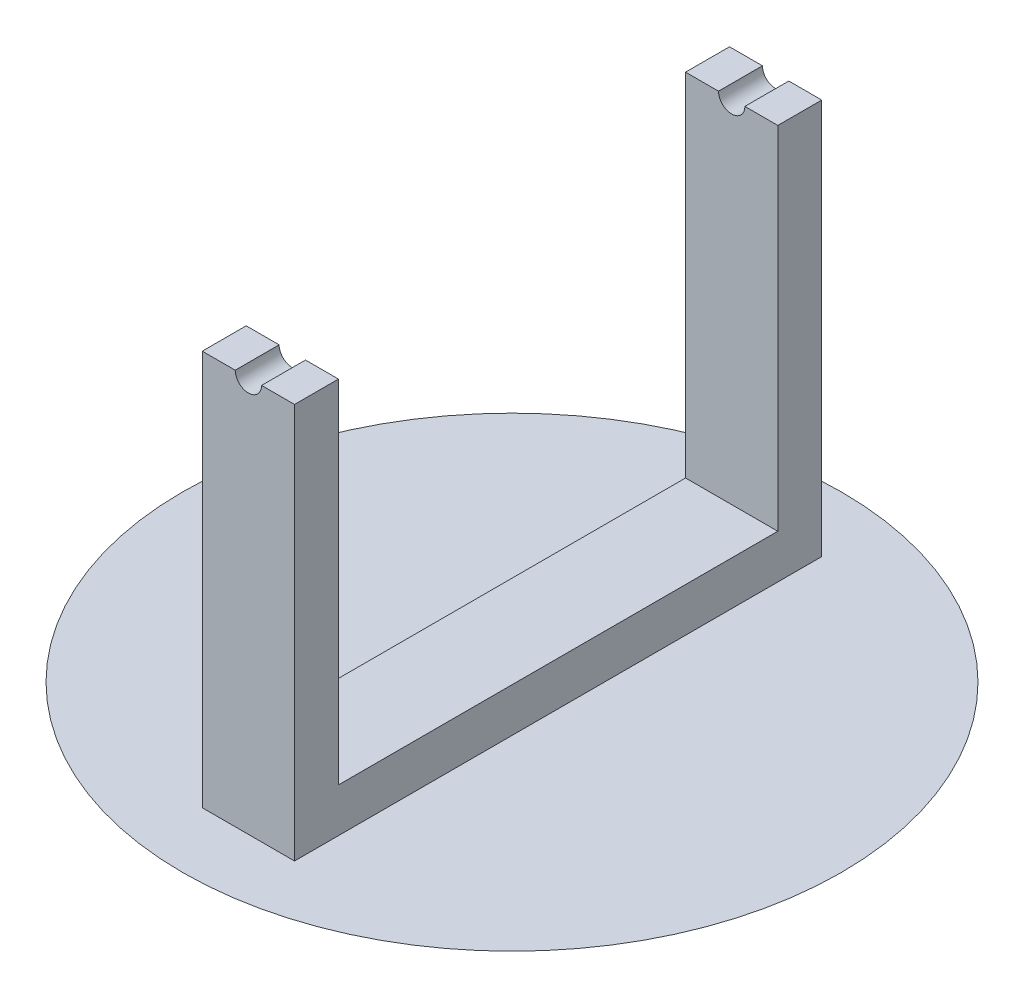
from build123d import *

# Parameters (mm, degrees)
BOSS_EXTRUDE1_DEPTH     = 21
CUT_EXTRUDE1_DEPTH      = 306.614135799
CUT_EXTRUDE1_DEPTH_BACK = 306.614135799
SKETCH3_R               = 6


with BuildPart() as part:
    # Sketch1 → Boss-Extrude1 (new, symmetric)
    with BuildSketch(Plane(origin=(0, 0, 0), x_dir=(0, 0, -1), z_dir=(1, 0, 0))):
        Polygon((-120, 0), (-100, 0), (-100, -160), (100, -160), (100, 0), (120, 0), (120, -180), (-120, -180), align=None)
    extrude(amount=BOSS_EXTRUDE1_DEPTH, both=True)

    # Sketch2 → Revolve1 (revolve)
    with BuildSketch(Plane.XY, mode=Mode.PRIVATE) as revolve1_sk:
        Polygon((0, -180), (150, -180), (79.954646314, -220), (0, -220), align=None)
    revolve(revolve1_sk.sketch.rotate(Axis((0, 87.726376394, 0), (0, -1, 0)), 90), axis=Axis((0, 87.726376394, 0), (0, -1, 0)))

    # Sketch3 → Cut-Extrude1 (cut, two sides: drawn at the far end of the back side and taken through both)
    with BuildSketch(Plane.XY.offset(-CUT_EXTRUDE1_DEPTH_BACK)):
        Circle(SKETCH3_R)
    extrude(amount=CUT_EXTRUDE1_DEPTH + CUT_EXTRUDE1_DEPTH_BACK, mode=Mode.SUBTRACT)


solid = part.part
